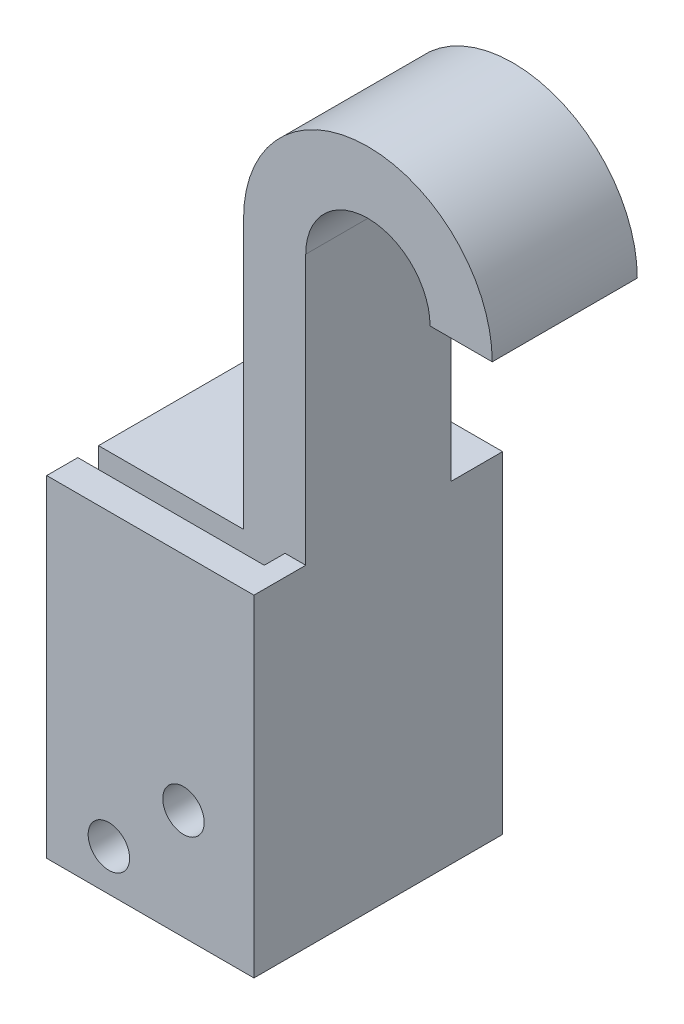
from build123d import *

# Parameters (mm, degrees)
SKETCH1_W               = 0.254
SKETCH1_H               = 25.4
SKETCH1_W_2             = 25.4
SKETCH1_H_2             = 152.4
BOSS_EXTRUDE1_DEPTH     = 76.2
SKETCH5_W               = 38.1
SKETCH5_H               = 368.3
BOSS_EXTRUDE2_DEPTH     = 44.45
SKETCH6_W               = 127
SKETCH6_H               = 203.2
BOSS_EXTRUDE3_DEPTH     = 76.2
CUT_EXTRUDE1_DEPTH      = 462.588658873
CUT_EXTRUDE1_DEPTH_BACK = 462.588658873
SKETCH7_R               = 12.7
SKETCH8_W               = 114.3
SKETCH8_H               = 190.5
CUT_EXTRUDE2_DEPTH      = 6.35


with BuildPart() as part:
    # Sketch1 → Boss-Extrude1 (new, symmetric)
    with BuildSketch(Plane.XY):
        with Locations((-25.527, 12.7)):
            Rectangle(SKETCH1_W, SKETCH1_H)
        with Locations((-12.7, 76.2)):
            Rectangle(SKETCH1_W_2, SKETCH1_H_2)
        Polygon((0, 152.4), (0, 0), (-25.4, 0), (-25.4, -25.4), (25.4, -25.4), (25.4, 177.8), (-25.4, 177.8), (-25.4, 152.4), align=None)
    extrude(amount=BOSS_EXTRUDE1_DEPTH, both=True)

    # Sketch5 → Boss-Extrude2 (add, symmetric)
    with BuildSketch(Plane.XY):
        with BuildLine():
            ThreePointArc((139.7, 342.9), (101.6, 381), (63.5, 342.9))
            Line((63.5, 342.9), (25.4, 342.9))
            ThreePointArc((25.4, 342.9), (101.6, 419.1), (177.8, 342.9))
            Line((177.8, 342.9), (139.7, 342.9))
        make_face()
        with Locations((44.45, 158.75)):
            Rectangle(SKETCH5_W, SKETCH5_H)
    extrude(amount=BOSS_EXTRUDE2_DEPTH, both=True)

    # Sketch6 → Boss-Extrude3 (add, symmetric)
    with BuildSketch(Plane.XY):
        with Locations((0, 76.2)):
            Rectangle(SKETCH6_W, SKETCH6_H)
    extrude(amount=BOSS_EXTRUDE3_DEPTH, both=True)

    # Sketch7 → Cut-Extrude1 (cut, two sides: drawn at the far end of the back side and taken through both)
    with BuildSketch(Plane.XY.offset(-CUT_EXTRUDE1_DEPTH_BACK)):
        with Locations((-25.4, 0)):
            Circle(SKETCH7_R)
        with Locations((20.32, 41.91)):
            Circle(SKETCH7_R)
    extrude(amount=CUT_EXTRUDE1_DEPTH + CUT_EXTRUDE1_DEPTH_BACK, mode=Mode.SUBTRACT)

    # Sketch8 → Cut-Extrude2 (cut, symmetric)
    with BuildSketch(Plane.XY.offset(50.8)):
        with Locations((-6.35, 82.55)):
            Rectangle(SKETCH8_W, SKETCH8_H)
    cut_extrude2 = extrude(amount=CUT_EXTRUDE2_DEPTH, both=True, mode=Mode.SUBTRACT)

    # Mirror1: Cut-Extrude2 across plane
    add(cut_extrude2.mirror(Plane.XY), mode=Mode.SUBTRACT)


solid = part.part
